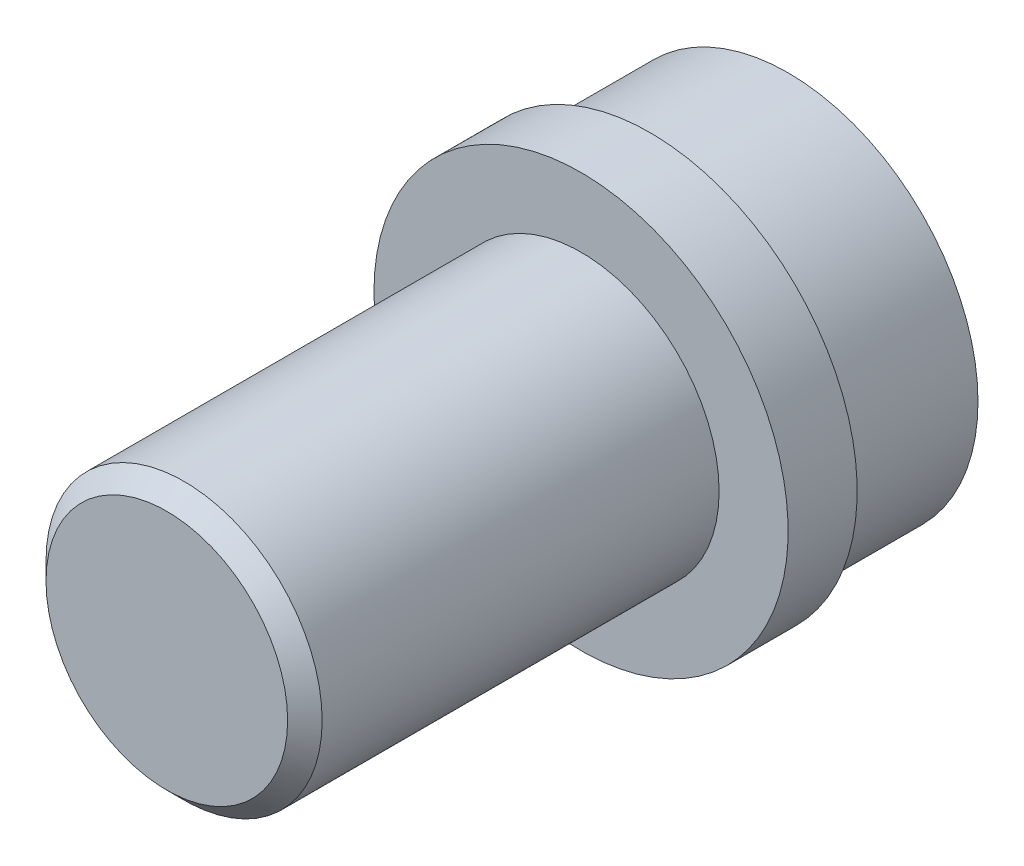
from build123d import *

# Parameters (mm, degrees)
SKETCH_1_R      = 4
EXTRUDE_1_DEPTH = 12
SKETCH_2_R      = 6
EXTRUDE_2_DEPTH = 2
SKETCH_3_R      = 5.5
EXTRUDE_3_DEPTH = 4
CHAMFER_1_SIZE  = 0.5


with BuildPart() as part:
    # 草图1 → 凸台-拉伸1 (new body)
    with BuildSketch(Plane.XY):
        Circle(SKETCH_1_R)
    extrude(amount=EXTRUDE_1_DEPTH)

    # 草图2 → 凸台-拉伸2 (add)
    with BuildSketch(Plane(origin=(0, 0, 0), x_dir=(-1, 0, 0), z_dir=(0, 0, -1))):
        Circle(SKETCH_2_R)
    extrude(amount=EXTRUDE_2_DEPTH)

    # 草图3 → 凸台-拉伸3 (add)
    with BuildSketch(Plane(origin=(0, 0, -2), x_dir=(-1, 0, 0), z_dir=(0, 0, -1))):
        Circle(SKETCH_3_R)
    extrude(amount=EXTRUDE_3_DEPTH)

    # 草图4 → 旋转1 (revolve)
    with BuildSketch(Plane(origin=(0, 0, 0), x_dir=(1, 0, 0), z_dir=(0, 1, 0))):
        with BuildLine():
            Line((0, 8.2), (0, 0.2))
            ThreePointArc((0, 0.2), (4, 4.2), (0, 8.2))
        make_face()
    revolve(axis=Axis((0, 0, -9.405734293), (0, 0, 1)))

    # 倒角1
    chamfer_1_edges = [part.edges().sort_by_distance(p)[0] for p in [
        (-4, 0, 12),
    ]]
    chamfer(chamfer_1_edges, length=CHAMFER_1_SIZE)


solid = part.part
